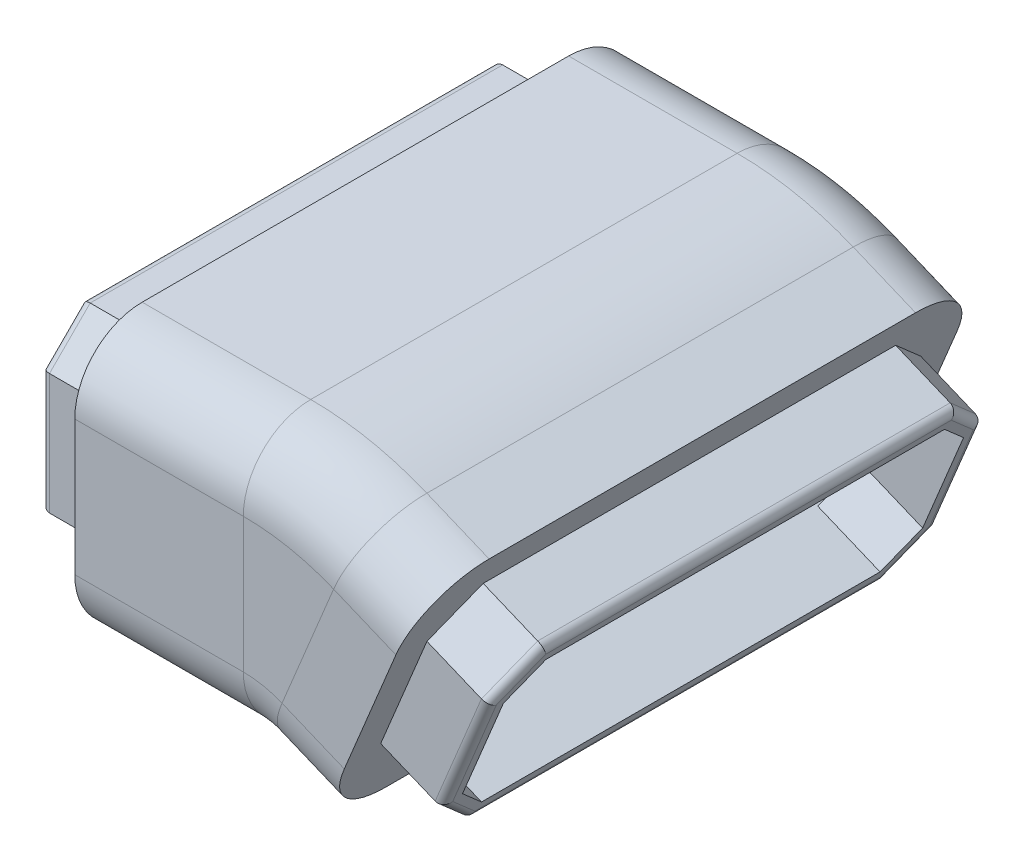
from build123d import *

# Parameters (mm, degrees)
BOSS_EXTRUDE1_DEPTH  = 4
SKETCH5_OUTSIDE_W    = 44.302
SKETCH5_OUTSIDE_H    = 28.685
CUT_EXTRUDE1_DEPTH   = 4
CUT_EXTRUDE3_DEPTH   = 4
BOSS_EXTRUDE3_DEPTH  = 8
MIRROR2_COPY_1_DEPTH = 4
MIRROR2_COPY_2_DEPTH = 8
FILLET3_R            = 0.5
BOSS_EXTRUDE4_DEPTH  = 4
CUT_EXTRUDE4_DEPTH   = 4
CUT_EXTRUDE5_DEPTH   = 4
BOSS_EXTRUDE5_DEPTH  = 4
MIRROR4_COPY_1_DEPTH = 4
MIRROR4_COPY_2_DEPTH = 4
FILLET4_R            = 0.5


with BuildPart() as part:
    # Sweep1: sweep along a path in Sketch2path
    with BuildLine(Plane.XY) as sweep1_path:
        Line((17.522352454, -2.291938404), (13.826834324, -0.761204675))
        ThreePointArc((13.826834324, -0.761204675), (11.95090322, -0.192147196), (10, 0))
        Line((10, 0), (0, 0))
    # Sketch3 → Sweep1 (sweep)
    with BuildSketch(Plane(origin=(0, 0, 0), x_dir=(0, 0, -1), z_dir=(1, 0, 0))):
        with BuildLine():
            Line((-16.65, -4), (-16.65, 4))
            ThreePointArc((-16.65, 4), (-15.478427125, 6.828427125), (-12.65, 8))
            Line((-12.65, 8), (12.65, 8))
            ThreePointArc((12.65, 8), (15.478427125, 6.828427125), (16.65, 4))
            Line((16.65, 4), (16.65, -4))
            ThreePointArc((16.65, -4), (15.478427125, -6.828427125), (12.65, -8))
            Line((12.65, -8), (-12.65, -8))
            ThreePointArc((-12.65, -8), (-15.478427125, -6.828427125), (-16.65, -4))
        make_face()
        with BuildLine():
            Line((-15.65, -4), (-15.65, 4))
            ThreePointArc((-15.65, 4), (-14.771320344, 6.121320344), (-12.65, 7))
            Line((-12.65, 7), (12.65, 7))
            ThreePointArc((12.65, 7), (14.771320344, 6.121320344), (15.65, 4))
            Line((15.65, 4), (15.65, -4))
            ThreePointArc((15.65, -4), (14.771320344, -6.121320344), (12.65, -7))
            Line((12.65, -7), (-12.65, -7))
            ThreePointArc((-12.65, -7), (-14.771320344, -6.121320344), (-15.65, -4))
        make_face(mode=Mode.SUBTRACT)
    sweep(path=sweep1_path.line)

    # Sketch4 → Boss-Extrude1 (add, symmetric)
    with BuildSketch(Plane.ZY):
        with BuildLine():
            Line((15.65, 4), (15.65, -4))
            ThreePointArc((15.65, -4), (14.771320344, -6.121320344), (12.65, -7))
            Line((12.65, -7), (-12.65, -7))
            ThreePointArc((-12.65, -7), (-14.771320344, -6.121320344), (-15.65, -4))
            Line((-15.65, -4), (-15.65, 4))
            ThreePointArc((-15.65, 4), (-14.771320344, 6.121320344), (-12.65, 7))
            Line((-12.65, 7), (12.65, 7))
            ThreePointArc((12.65, 7), (14.771320344, 6.121320344), (15.65, 4))
        make_face()
        with BuildLine():
            Line((-13.65, -4), (-13.65, 4))
            ThreePointArc((-13.65, 4), (-13.357106781, 4.707106781), (-12.65, 5))
            Line((-12.65, 5), (12.65, 5))
            ThreePointArc((12.65, 5), (13.357106781, 4.707106781), (13.65, 4))
            Line((13.65, 4), (13.65, -4))
            ThreePointArc((13.65, -4), (13.357106781, -4.707106781), (12.65, -5))
            Line((12.65, -5), (-12.65, -5))
            ThreePointArc((-12.65, -5), (-13.357106781, -4.707106781), (-13.65, -4))
        make_face(mode=Mode.SUBTRACT)
    extrude(amount=BOSS_EXTRUDE1_DEPTH, both=True)

    # Sketch5 outside → Cut-Extrude1 (cut)
    # profile 1 of 2: a face of its own
    with BuildSketch(Plane.ZY.offset(4)):
        with Locations((0, -0.8415)):
            Rectangle(SKETCH5_OUTSIDE_W, SKETCH5_OUTSIDE_H)
        with BuildLine():
            Line((12.65, 6), (-12.65, 6))
            ThreePointArc((-12.65, 6), (-14.064213562, 5.414213562), (-14.65, 4))
            Line((-14.65, 4), (-14.65, -4))
            ThreePointArc((-14.65, -4), (-14.064213562, -5.414213562), (-12.65, -6))
            Line((-12.65, -6), (12.65, -6))
            ThreePointArc((12.65, -6), (14.064213562, -5.414213562), (14.65, -4))
            Line((14.65, -4), (14.65, 4))
            ThreePointArc((14.65, 4), (14.064213562, 5.414213562), (12.65, 6))
        make_face(mode=Mode.SUBTRACT)
    # profile 2 of 2: a face of its own
    with BuildSketch(Plane.ZY.offset(4)):
        with BuildLine():
            Line((12.65, 5), (-12.65, 5))
            ThreePointArc((-12.65, 5), (-13.357106781, 4.707106781), (-13.65, 4))
            Line((-13.65, 4), (-13.65, -4))
            ThreePointArc((-13.65, -4), (-13.357106781, -4.707106781), (-12.65, -5))
            Line((-12.65, -5), (12.65, -5))
            ThreePointArc((12.65, -5), (13.357106781, -4.707106781), (13.65, -4))
            Line((13.65, -4), (13.65, 4))
            ThreePointArc((13.65, 4), (13.357106781, 4.707106781), (12.65, 5))
        make_face()
    extrude(amount=-CUT_EXTRUDE1_DEPTH, mode=Mode.SUBTRACT)

    # Sketch11 → Cut-Extrude3 (cut)
    with BuildSketch(Plane.ZY.offset(4)):
        Polygon((-14.65, 6), (-14.65, 3.585786438), (-12.235786438, 6), align=None)
    cut_extrude3 = extrude(amount=-CUT_EXTRUDE3_DEPTH, mode=Mode.SUBTRACT)

    # Sketch12 → Boss-Extrude3 (add)
    with BuildSketch(Plane.ZY.offset(4)):
        Polygon((-14.65, 3.585786438), (-12.235786438, 6), (-11.528679656, 5.292893219), (-13.942893219, 2.878679656), align=None)
    boss_extrude3 = extrude(amount=-BOSS_EXTRUDE3_DEPTH)

    # Mirror1: Cut-Extrude3, Boss-Extrude3 across plane
    add(cut_extrude3.mirror(Plane.XY), mode=Mode.SUBTRACT)
    add(boss_extrude3.mirror(Plane.XY))

    # Mirror2: Cut-Extrude3, Boss-Extrude3 across plane
    add(cut_extrude3.mirror(Plane.ZX), mode=Mode.SUBTRACT)
    add(boss_extrude3.mirror(Plane.ZX))

    # Mirror2 copy 1 sketch → Mirror2 copy 1 (cut)
    with BuildSketch(Plane(origin=(-4, 0, 0), x_dir=(0, 0, -1), z_dir=(-1, 0, 0))):
        Polygon((-14.65, 6), (-14.65, 3.585786438), (-12.235786438, 6), align=None)
    extrude(amount=-MIRROR2_COPY_1_DEPTH, mode=Mode.SUBTRACT)

    # Mirror2 copy 2 sketch → Mirror2 copy 2 (add)
    with BuildSketch(Plane(origin=(-4, 0, 0), x_dir=(0, 0, -1), z_dir=(-1, 0, 0))):
        Polygon((-14.65, 3.585786438), (-12.235786438, 6), (-11.528679656, 5.292893219), (-13.942893219, 2.878679656), align=None)
    extrude(amount=-MIRROR2_COPY_2_DEPTH)

    # Fillet3
    fillet3_edges = [part.edges().sort_by_distance(p)[0] for p in [
        (4, 6.121320344, 14.771320344),
        (4, 7, 0),
        (4, 6.121320344, -14.771320344),
        (4, 0, -15.65),
        (4, -6.121320344, -14.771320344),
        (4, -7, 0),
        (4, -6.121320344, 14.771320344),
        (4, 0, 15.65),
        (-4, 0, -14.65),
        (-4, 4.792893219, -13.442893219),
        (4, 0, -13.65),
        (4, 4.085786438, -12.735786438),
        (-4, 6, 0),
        (-4, 4.792893219, 13.442893219),
        (4, 5, 0),
        (4, 4.085786438, 12.735786438),
        (-4, 0, 14.65),
        (-4, -4.792893219, 13.442893219),
        (4, 0, 13.65),
        (4, -4.085786438, 12.735786438),
        (-4, -6, 0),
        (-4, -4.792893219, -13.442893219),
        (4, -5, 0),
        (4, -4.085786438, -12.735786438),
    ]]
    fillet(fillet3_edges, radius=FILLET3_R)

    # Sketch14 → Boss-Extrude4 (add, symmetric)
    with BuildSketch(Plane(origin=(15.766585942, -6.530733729, 0), x_dir=(0, 0, -1), z_dir=(0.9238795325112864, -0.38268343236509084, 0))):
        with BuildLine():
            Line((12.65, 11.588038999), (-12.65, 11.588038999))
            ThreePointArc((-12.65, 11.588038999), (-14.771320344, 10.709359342), (-15.65, 8.588038999))
            Line((-15.65, 8.588038999), (-15.65, 0.588038999))
            ThreePointArc((-15.65, 0.588038999), (-14.771320344, -1.533281345), (-12.65, -2.411961001))
            Line((-12.65, -2.411961001), (12.65, -2.411961001))
            ThreePointArc((12.65, -2.411961001), (14.771320344, -1.533281345), (15.65, 0.588038999))
            Line((15.65, 0.588038999), (15.65, 8.588038999))
            ThreePointArc((15.65, 8.588038999), (14.771320344, 10.709359342), (12.65, 11.588038999))
        make_face()
        with BuildLine():
            Line((12.65, 9.588038999), (-12.65, 9.588038999))
            ThreePointArc((-12.65, 9.588038999), (-13.357106781, 9.29514578), (-13.65, 8.588038999))
            Line((-13.65, 8.588038999), (-13.65, 0.588038999))
            ThreePointArc((-13.65, 0.588038999), (-13.357106781, -0.119067783), (-12.65, -0.411961001))
            Line((-12.65, -0.411961001), (12.65, -0.411961001))
            ThreePointArc((12.65, -0.411961001), (13.357106781, -0.119067783), (13.65, 0.588038999))
            Line((13.65, 0.588038999), (13.65, 8.588038999))
            ThreePointArc((13.65, 8.588038999), (13.357106781, 9.29514578), (12.65, 9.588038999))
        make_face(mode=Mode.SUBTRACT)
    extrude(amount=BOSS_EXTRUDE4_DEPTH, both=True)

    # Sketch15 → Cut-Extrude4 (cut)
    with BuildSketch(Plane(origin=(19.462104072, -8.061467459, 0), x_dir=(0, 0, -1), z_dir=(0.9238795325112863, -0.3826834323650909, 0))):
        with BuildLine():
            Line((12.65, 11.588038999), (-12.65, 11.588038999))
            ThreePointArc((-12.65, 11.588038999), (-14.771320344, 10.709359342), (-15.65, 8.588038999))
            Line((-15.65, 8.588038999), (-15.65, 0.588038999))
            ThreePointArc((-15.65, 0.588038999), (-14.771320344, -1.533281345), (-12.65, -2.411961001))
            Line((-12.65, -2.411961001), (12.65, -2.411961001))
            ThreePointArc((12.65, -2.411961001), (14.771320344, -1.533281345), (15.65, 0.588038999))
            Line((15.65, 0.588038999), (15.65, 8.588038999))
            ThreePointArc((15.65, 8.588038999), (14.771320344, 10.709359342), (12.65, 11.588038999))
        make_face()
        with BuildLine():
            Line((12.65, 10.588038999), (-12.65, 10.588038999))
            ThreePointArc((-12.65, 10.588038999), (-14.064213562, 10.002252561), (-14.65, 8.588038999))
            Line((-14.65, 8.588038999), (-14.65, 0.588038999))
            ThreePointArc((-14.65, 0.588038999), (-14.064213562, -0.826174564), (-12.65, -1.411961001))
            Line((-12.65, -1.411961001), (12.65, -1.411961001))
            ThreePointArc((12.65, -1.411961001), (14.064213562, -0.826174564), (14.65, 0.588038999))
            Line((14.65, 0.588038999), (14.65, 8.588038999))
            ThreePointArc((14.65, 8.588038999), (14.064213562, 10.002252561), (12.65, 10.588038999))
        make_face(mode=Mode.SUBTRACT)
    extrude(amount=-CUT_EXTRUDE4_DEPTH, mode=Mode.SUBTRACT)

    # Sketch16 → Cut-Extrude5 (cut)
    with BuildSketch(Plane(origin=(19.462104072, -8.061467459, 0), x_dir=(0, 0, -1), z_dir=(0.9238795325112863, -0.3826834323650909, 0))):
        Polygon((-14.65, 8.173825436), (-12.235786438, 10.588038999), (-14.65, 10.588038999), align=None)
    cut_extrude5 = extrude(amount=-CUT_EXTRUDE5_DEPTH, mode=Mode.SUBTRACT)

    # Sketch17 → Boss-Extrude5 (add)
    with BuildSketch(Plane(origin=(19.462104072, -8.061467459, 0), x_dir=(0, 0, -1), z_dir=(0.9238795325112863, -0.3826834323650909, 0))):
        Polygon((-14.65, 8.173825436), (-12.235786438, 10.588038999), (-11.528679656, 9.880932217), (-13.942893219, 7.466718655), align=None)
    boss_extrude5 = extrude(amount=-BOSS_EXTRUDE5_DEPTH)

    # Mirror3: Cut-Extrude5, Boss-Extrude5 across plane
    add(cut_extrude5.mirror(Plane.XY), mode=Mode.SUBTRACT)
    add(boss_extrude5.mirror(Plane.XY))

    # Mirror4: Cut-Extrude5, Boss-Extrude5 across plane
    add(cut_extrude5.mirror(Plane(origin=(1.755766512, 4.238795325, 0), x_dir=(0, 0, 1), z_dir=(0.38268343236509106, 0.9238795325112864, 0))), mode=Mode.SUBTRACT)
    add(boss_extrude5.mirror(Plane(origin=(1.755766512, 4.238795325, 0), x_dir=(0, 0, 1), z_dir=(0.38268343236509106, 0.9238795325112864, 0))))

    # Mirror4 copy 1 sketch → Mirror4 copy 1 (cut)
    with BuildSketch(Plane(origin=(22.973637096, 0.416123191, 0), x_dir=(0, 0, 1), z_dir=(0.9238795325112863, -0.3826834323650912, 0))):
        Polygon((-14.65, 8.173825436), (-12.235786438, 10.588038999), (-14.65, 10.588038999), align=None)
    extrude(amount=-MIRROR4_COPY_1_DEPTH, mode=Mode.SUBTRACT)

    # Mirror4 copy 2 sketch → Mirror4 copy 2 (add)
    with BuildSketch(Plane(origin=(22.973637096, 0.416123191, 0), x_dir=(0, 0, 1), z_dir=(0.9238795325112863, -0.3826834323650912, 0))):
        Polygon((-14.65, 8.173825436), (-12.235786438, 10.588038999), (-11.528679656, 9.880932217), (-13.942893219, 7.466718655), align=None)
    extrude(amount=-MIRROR4_COPY_2_DEPTH)

    # Fillet4
    fillet4_edges = [part.edges().sort_by_distance(p)[0] for p in [
        (16.169362203, 4.894157902, 14.771320344),
        (13.826834324, -0.761204675, 15.65),
        (11.484306444, -6.416567252, 14.771320344),
        (11.148050297, -7.228361402, 0),
        (11.484306444, -6.416567252, -14.771320344),
        (13.826834324, -0.761204675, -15.65),
        (16.169362203, 4.894157902, -14.771320344),
        (16.50561835, 5.705952053, 0),
        (15.628166103, 3.587594938, -13.357106781),
        (15.740251485, 3.858192988, 0),
        (15.628166103, 3.587594938, 13.357106781),
        (13.826834324, -0.761204675, 13.65),
        (12.025502544, -5.110004287, 13.357106781),
        (11.913417162, -5.380602337, 0),
        (12.025502544, -5.110004287, -13.357106781),
        (13.826834324, -0.761204675, -13.65),
        (21.217870584, -3.822672134, 14.65),
        (23.052031412, 0.605383813, 13.442893219),
        (23.513971178, 1.720605061, 0),
        (23.052031412, 0.605383813, -13.442893219),
        (21.217870584, -3.822672134, -14.65),
        (19.383709756, -8.25072808, -13.442893219),
        (18.92176999, -9.365949329, 0),
        (19.383709756, -8.25072808, 13.442893219),
    ]]
    fillet(fillet4_edges, radius=FILLET4_R)


solid = part.part
